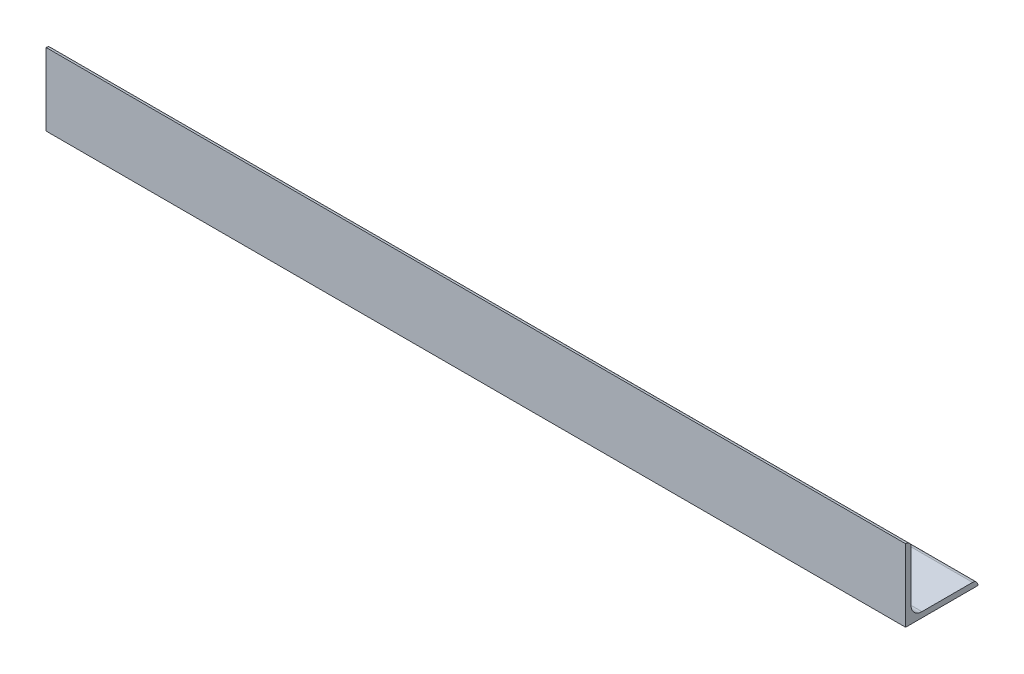
from build123d import *

# Parameters (mm, degrees)
L_ANGLE_EQUAL_40X40X3_9_DEPTH = 475


with BuildPart() as part:
    # Sketch13 → L angle (equal) 40X40X3(9) (new body)
    with BuildSketch(Plane(origin=(0, 0, 0), x_dir=(0, 0, -1), z_dir=(1, 0, 0))):
        with BuildLine():
            Line((0, 40), (0, 0))
            Line((0, 0), (40, 0))
            ThreePointArc((40, 0), (39.121320344, 2.121320344), (37, 3))
            Line((37, 3), (9, 3))
            ThreePointArc((9, 3), (4.757359313, 4.757359313), (3, 9))
            Line((3, 9), (3, 37))
            ThreePointArc((3, 37), (2.121320344, 39.121320344), (0, 40))
        make_face()
    extrude(amount=L_ANGLE_EQUAL_40X40X3_9_DEPTH)


solid = part.part
